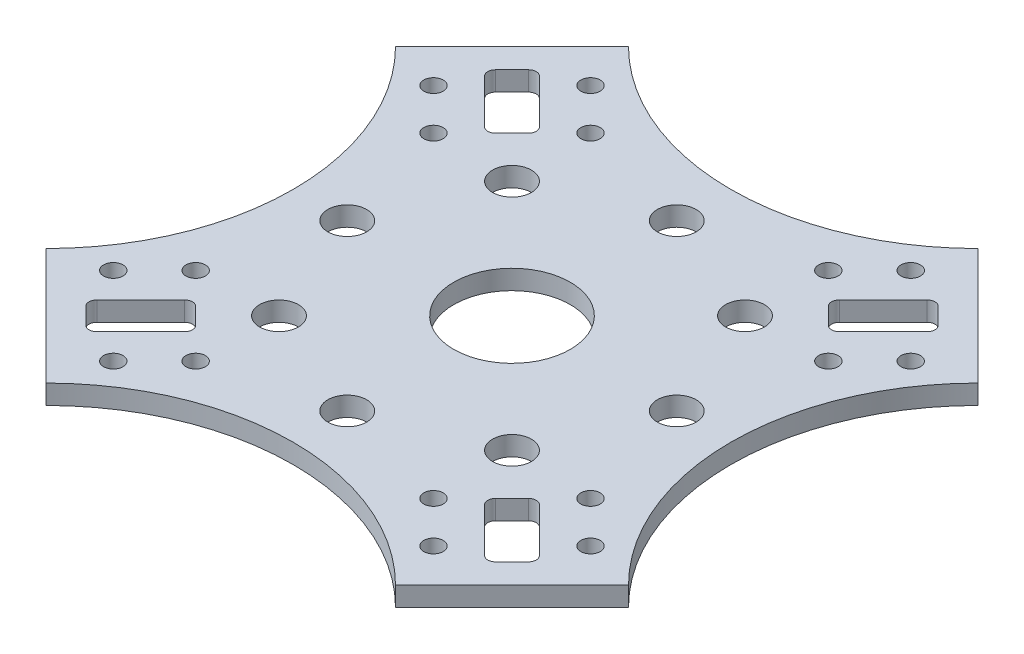
from build123d import *

# Parameters (mm, degrees)
SKETCH2_R           = 15
SKETCH2_R_2         = 5
SKETCH2_R_3         = 2.5
BOSS_EXTRUDE1_DEPTH = 5


with BuildPart() as part:
    # Sketch2 → Boss-Extrude1 (new body)
    with BuildSketch(Plane(origin=(0, 0, 0), x_dir=(1, 0, 0), z_dir=(0, 1, 0))):
        with BuildLine():
            Line((45, 75), (75, 45))
            ThreePointArc((75, 45), (56.360389693, 0), (75, -45))
            Line((75, -45), (45, -75))
            ThreePointArc((45, -75), (0, -56.360389693), (-45, -75))
            Line((-45, -75), (-75, -45))
            ThreePointArc((-75, -45), (-56.360389693, 0), (-75, 45))
            Line((-75, 45), (-45, 75))
            ThreePointArc((-45, 75), (0, 56.360389693), (45, 75))
        make_face()
        with Locations(Location((0, 0, 0), (0, 0, 270))):
            Circle(SKETCH2_R, mode=Mode.SUBTRACT)
        with Locations(Location((30, 30, 0), (0, 0, 270))):
            Circle(SKETCH2_R_2, mode=Mode.SUBTRACT)
        with Locations(Location((42.426406871, 0, 0), (0, 0, 270))):
            Circle(SKETCH2_R_2, mode=Mode.SUBTRACT)
        with Locations(Location((30, -30, 0), (0, 0, 270))):
            Circle(SKETCH2_R_2, mode=Mode.SUBTRACT)
        with Locations(Location((0, -42.426406871, 0), (0, 0, 270))):
            Circle(SKETCH2_R_2, mode=Mode.SUBTRACT)
        with Locations(Location((-30, -30, 0), (0, 0, 270))):
            Circle(SKETCH2_R_2, mode=Mode.SUBTRACT)
        with Locations(Location((-42.426406871, 0, 0), (0, 0, 270))):
            Circle(SKETCH2_R_2, mode=Mode.SUBTRACT)
        with Locations(Location((-30, 30, 0), (0, 0, 270))):
            Circle(SKETCH2_R_2, mode=Mode.SUBTRACT)
        with Locations(Location((0, 42.426406871, 0), (0, 0, 270))):
            Circle(SKETCH2_R_2, mode=Mode.SUBTRACT)
        with Locations(Location((41.228106405, 61.448235065, 0), (0, 0, 270))):
            Circle(SKETCH2_R_3, mode=Mode.SUBTRACT)
        with Locations(Location((30.621504688, 50.841633347, 0), (0, 0, 270))):
            Circle(SKETCH2_R_3, mode=Mode.SUBTRACT)
        with Locations(Location((61.448235065, 41.228106405, 0), (0, 0, 90))):
            Circle(SKETCH2_R_3, mode=Mode.SUBTRACT)
        with Locations(Location((50.841633347, 30.621504688, 0), (0, 0, 90))):
            Circle(SKETCH2_R_3, mode=Mode.SUBTRACT)
        with Locations(Location((61.448235065, -41.228106405, 0), (0, 0, 270))):
            Circle(SKETCH2_R_3, mode=Mode.SUBTRACT)
        with Locations(Location((50.841633347, -30.621504688, 0), (0, 0, 270))):
            Circle(SKETCH2_R_3, mode=Mode.SUBTRACT)
        with Locations(Location((41.228106405, -61.448235065, 0), (0, 0, 90))):
            Circle(SKETCH2_R_3, mode=Mode.SUBTRACT)
        with Locations(Location((30.621504688, -50.841633347, 0), (0, 0, 90))):
            Circle(SKETCH2_R_3, mode=Mode.SUBTRACT)
        with Locations(Location((-41.228106405, -61.448235065, 0), (0, 0, 270))):
            Circle(SKETCH2_R_3, mode=Mode.SUBTRACT)
        with Locations(Location((-30.621504688, -50.841633347, 0), (0, 0, 270))):
            Circle(SKETCH2_R_3, mode=Mode.SUBTRACT)
        with Locations(Location((-61.448235065, -41.228106405, 0), (0, 0, 90))):
            Circle(SKETCH2_R_3, mode=Mode.SUBTRACT)
        with Locations(Location((-50.841633347, -30.621504688, 0), (0, 0, 90))):
            Circle(SKETCH2_R_3, mode=Mode.SUBTRACT)
        with Locations(Location((-61.448235065, 41.228106405, 0), (0, 0, 270))):
            Circle(SKETCH2_R_3, mode=Mode.SUBTRACT)
        with Locations(Location((-50.841633347, 30.621504688, 0), (0, 0, 270))):
            Circle(SKETCH2_R_3, mode=Mode.SUBTRACT)
        with Locations(Location((-41.228106405, 61.448235065, 0), (0, 0, 90))):
            Circle(SKETCH2_R_3, mode=Mode.SUBTRACT)
        with Locations(Location((-30.621504688, 50.841633347, 0), (0, 0, 90))):
            Circle(SKETCH2_R_3, mode=Mode.SUBTRACT)
        with BuildLine():
            Line((38.610248674, 42.852889361), (42.852889361, 38.610248674))
            ThreePointArc((42.852889361, 38.610248674), (44.267102923, 38.024462236), (45.681316486, 38.610248674))
            Line((45.681316486, 38.610248674), (56.995024985, 49.923957173))
            ThreePointArc((56.995024985, 49.923957173), (57.580811422, 51.338170735), (56.995024985, 52.752384297))
            Line((56.995024985, 52.752384297), (52.752384297, 56.995024985))
            ThreePointArc((52.752384297, 56.995024985), (51.338170735, 57.580811422), (49.923957173, 56.995024985))
            Line((49.923957173, 56.995024985), (38.610248674, 45.681316486))
            ThreePointArc((38.610248674, 45.681316486), (38.024462236, 44.267102923), (38.610248674, 42.852889361))
        make_face(mode=Mode.SUBTRACT)
        with BuildLine():
            Line((45.681316486, -38.610248674), (56.995024985, -49.923957173))
            ThreePointArc((56.995024985, -49.923957173), (57.580811422, -51.338170735), (56.995024985, -52.752384297))
            Line((56.995024985, -52.752384297), (52.752384297, -56.995024985))
            ThreePointArc((52.752384297, -56.995024985), (51.338170735, -57.580811422), (49.923957173, -56.995024985))
            Line((49.923957173, -56.995024985), (38.610248674, -45.681316486))
            ThreePointArc((38.610248674, -45.681316486), (38.024462236, -44.267102923), (38.610248674, -42.852889361))
            Line((38.610248674, -42.852889361), (42.852889361, -38.610248674))
            ThreePointArc((42.852889361, -38.610248674), (44.267102923, -38.024462236), (45.681316486, -38.610248674))
        make_face(mode=Mode.SUBTRACT)
        with BuildLine():
            Line((-38.610248674, -45.681316486), (-49.923957173, -56.995024985))
            ThreePointArc((-49.923957173, -56.995024985), (-51.338170735, -57.580811422), (-52.752384297, -56.995024985))
            Line((-52.752384297, -56.995024985), (-56.995024985, -52.752384297))
            ThreePointArc((-56.995024985, -52.752384297), (-57.580811422, -51.338170735), (-56.995024985, -49.923957173))
            Line((-56.995024985, -49.923957173), (-45.681316486, -38.610248674))
            ThreePointArc((-45.681316486, -38.610248674), (-44.267102923, -38.024462236), (-42.852889361, -38.610248674))
            Line((-42.852889361, -38.610248674), (-38.610248674, -42.852889361))
            ThreePointArc((-38.610248674, -42.852889361), (-38.024462236, -44.267102923), (-38.610248674, -45.681316486))
        make_face(mode=Mode.SUBTRACT)
        with BuildLine():
            Line((-45.681316486, 38.610248674), (-56.995024985, 49.923957173))
            ThreePointArc((-56.995024985, 49.923957173), (-57.580811422, 51.338170735), (-56.995024985, 52.752384297))
            Line((-56.995024985, 52.752384297), (-52.752384297, 56.995024985))
            ThreePointArc((-52.752384297, 56.995024985), (-51.338170735, 57.580811422), (-49.923957173, 56.995024985))
            Line((-49.923957173, 56.995024985), (-38.610248674, 45.681316486))
            ThreePointArc((-38.610248674, 45.681316486), (-38.024462236, 44.267102923), (-38.610248674, 42.852889361))
            Line((-38.610248674, 42.852889361), (-42.852889361, 38.610248674))
            ThreePointArc((-42.852889361, 38.610248674), (-44.267102923, 38.024462236), (-45.681316486, 38.610248674))
        make_face(mode=Mode.SUBTRACT)
    extrude(amount=-BOSS_EXTRUDE1_DEPTH)


solid = part.part
